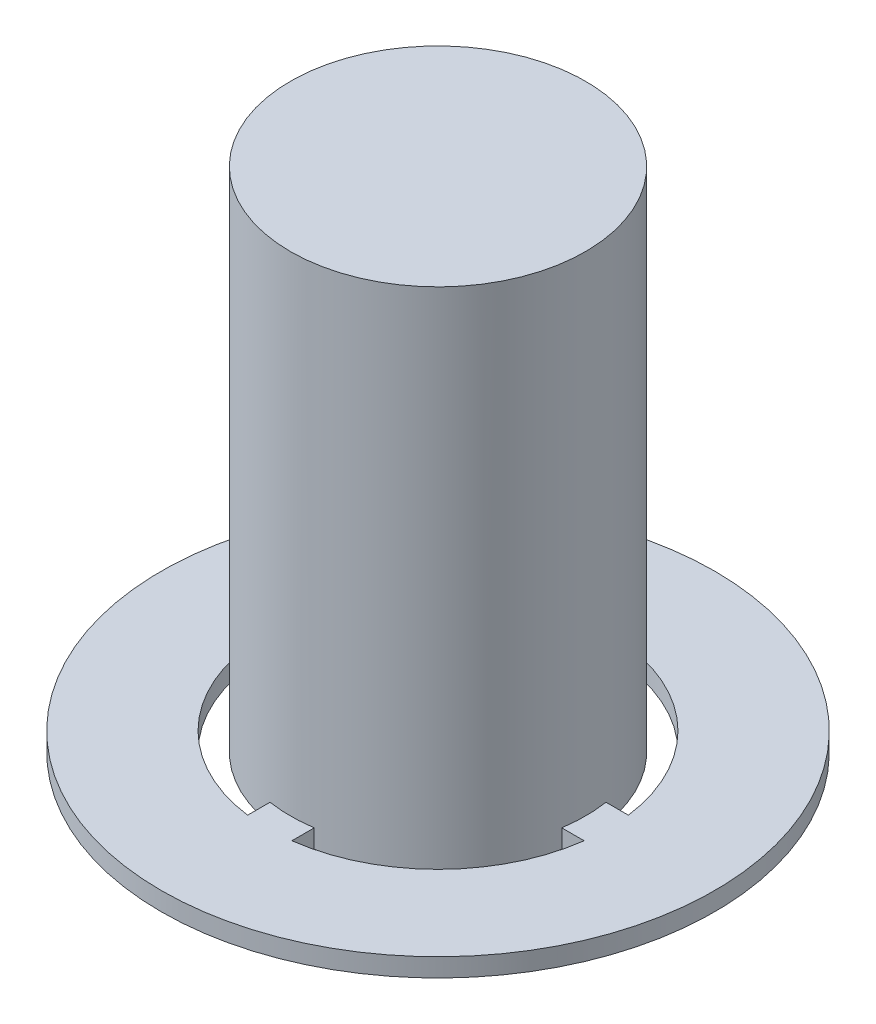
from build123d import *

# Parameters (mm, degrees)
SKETCH1_R           = 4
BOSS_EXTRUDE1_DEPTH = 13.75
SKETCH2_R           = 7.5
SKETCH2_R_2         = 4.6
BOSS_EXTRUDE2_DEPTH = 0.5
BOSS_EXTRUDE3_DEPTH = 0.5


with BuildPart() as part:
    # Sketch1 → Boss-Extrude1 (new body)
    with BuildSketch(Plane(origin=(0, 0, 0), x_dir=(1, 0, 0), z_dir=(0, 1, 0))):
        with Locations(Location((0, 0, 0), (0, 0, 270))):
            Circle(SKETCH1_R)
    extrude(amount=BOSS_EXTRUDE1_DEPTH)



with BuildPart() as body_2:
    # Sketch2 → Boss-Extrude2 (new body)
    with BuildSketch(Plane(origin=(0, 0, 0), x_dir=(-1, 0, 0), z_dir=(0, -1, 0))):
        with Locations(Location((0, 0, 0), (0, 0, 90))):
            Circle(SKETCH2_R)
        with Locations(Location((0, 0, 0), (0, 0, 90))):
            Circle(SKETCH2_R_2, mode=Mode.SUBTRACT)
    extrude(amount=-BOSS_EXTRUDE2_DEPTH)


with BuildPart() as part_1:
    add(part.part)

    add(body_2.part)  # Boss-Extrude3 merges body 2
    # Sketch3 → Boss-Extrude3 (add)
    with BuildSketch(Plane(origin=(0, 0, 0), x_dir=(-1, 0, 0), z_dir=(0, -1, 0))):
        with BuildLine():
            ThreePointArc((4.5607017, -0.6), (4.6, 0), (4.5607017, 0.6))
            Line((4.5607017, 0.6), (3.954743987, 0.6))
            ThreePointArc((3.954743987, 0.6), (4, 0), (3.954743987, -0.6))
            Line((3.954743987, -0.6), (4.5607017, -0.6))
        make_face()
        with BuildLine():
            Line((0.6, 3.954743987), (0.6, 4.5607017))
            ThreePointArc((0.6, 4.5607017), (0, 4.6), (-0.6, 4.5607017))
            Line((-0.6, 4.5607017), (-0.6, 3.954743987))
            ThreePointArc((-0.6, 3.954743987), (0, 4), (0.6, 3.954743987))
        make_face()
        with BuildLine():
            ThreePointArc((-0.6, -4.5607017), (0, -4.6), (0.6, -4.5607017))
            Line((0.6, -4.5607017), (0.6, -3.954743987))
            ThreePointArc((0.6, -3.954743987), (0, -4), (-0.6, -3.954743987))
            Line((-0.6, -3.954743987), (-0.6, -4.5607017))
        make_face()
        with BuildLine():
            Line((-3.954743987, 0.6), (-4.5607017, 0.6))
            ThreePointArc((-4.5607017, 0.6), (-4.6, 0), (-4.5607017, -0.6))
            Line((-4.5607017, -0.6), (-3.954743987, -0.6))
            ThreePointArc((-3.954743987, -0.6), (-4, 0), (-3.954743987, 0.6))
        make_face()
    extrude(amount=-BOSS_EXTRUDE3_DEPTH)


solid = part_1.part
